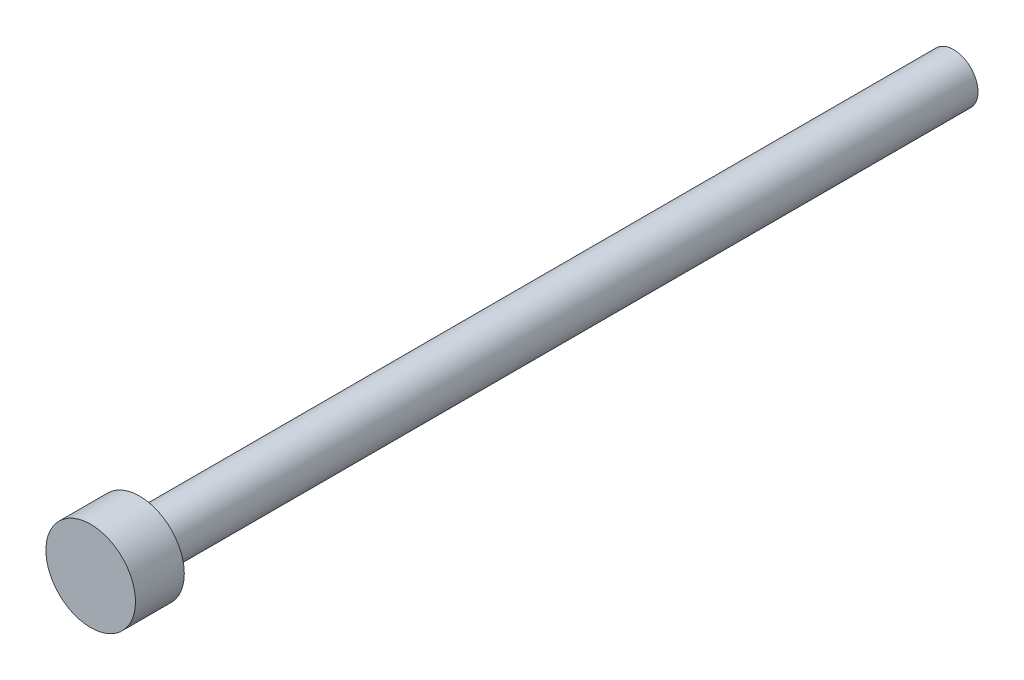
from build123d import *

# Parameters (mm, degrees)
SHANK_NOMINAL_THREAD_ENVELOPE_START     = -50
SHANK_NOMINAL_THREAD_ENVELOPE_PROFILE_R = 1.5
SHANK_NOMINAL_THREAD_ENVELOPE_DEPTH     = 50
SOCKET_HEAD_ENVELOPE_PROFILE_R          = 2.75
SOCKET_HEAD_ENVELOPE_DEPTH              = 3


with BuildPart() as part:
    # Shank_nominal_thread_envelope_profile → Shank_nominal_thread_envelope (new body)
    with BuildSketch(Plane.XY.offset(SHANK_NOMINAL_THREAD_ENVELOPE_START)):
        Circle(SHANK_NOMINAL_THREAD_ENVELOPE_PROFILE_R)
    extrude(amount=SHANK_NOMINAL_THREAD_ENVELOPE_DEPTH)

    # Socket_head_envelope_profile → Socket_head_envelope (add)
    with BuildSketch(Plane.XY):
        Circle(SOCKET_HEAD_ENVELOPE_PROFILE_R)
    extrude(amount=SOCKET_HEAD_ENVELOPE_DEPTH)


solid = part.part
